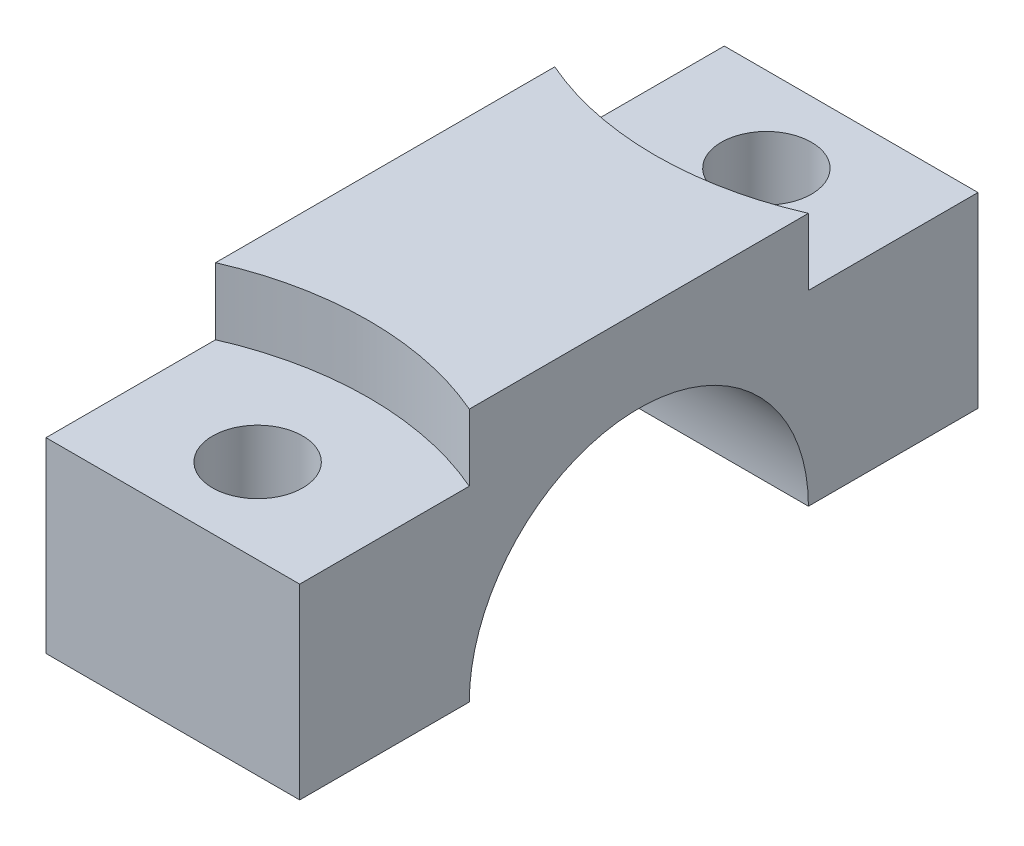
from build123d import *

# Parameters (mm, degrees)
SKETCH1_W           = 19
SKETCH1_H           = 50.8
SKETCH1_R           = 3.375
BOSS_EXTRUDE1_DEPTH = 14
BOSS_EXTRUDE2_DEPTH = 5
SKETCH2_R           = 12.7
CUT_EXTRUDE1_DEPTH  = 57.014640943


with BuildPart() as part:
    # Sketch1 → Boss-Extrude1 (new body)
    with BuildSketch(Plane(origin=(0, 0, 0), x_dir=(1, 0, 0), z_dir=(0, 1, 0))):
        with Locations((9.5, 25.4)):
            Rectangle(SKETCH1_W, SKETCH1_H)
        with Locations((9.5, 6.35)):
            Circle(SKETCH1_R, mode=Mode.SUBTRACT)
        with Locations((9.5, 44.45)):
            Circle(SKETCH1_R, mode=Mode.SUBTRACT)
    extrude(amount=-BOSS_EXTRUDE1_DEPTH)

    # Sketch1<3> → Boss-Extrude2 (add)
    with BuildSketch(Plane(origin=(0, 0, 0), x_dir=(1, 0, 0), z_dir=(0, 1, 0))):
        with BuildLine():
            Line((0, 38.1), (0, 12.7))
            ThreePointArc((0, 12.7), (9.5, 14.679128857), (19, 12.7))
            Line((19, 12.7), (19, 38.1))
            ThreePointArc((19, 38.1), (9.5, 36.120871143), (0, 38.1))
        make_face()
    extrude(amount=BOSS_EXTRUDE2_DEPTH)

    # Sketch2 → Cut-Extrude1 (cut, through all)
    with BuildSketch(Plane(origin=(19, 0, 0), x_dir=(0, 0, -1), z_dir=(1, 0, 0))):
        with Locations((25.4, -14)):
            Circle(SKETCH2_R)
    extrude(amount=-CUT_EXTRUDE1_DEPTH, mode=Mode.SUBTRACT)


solid = part.part
